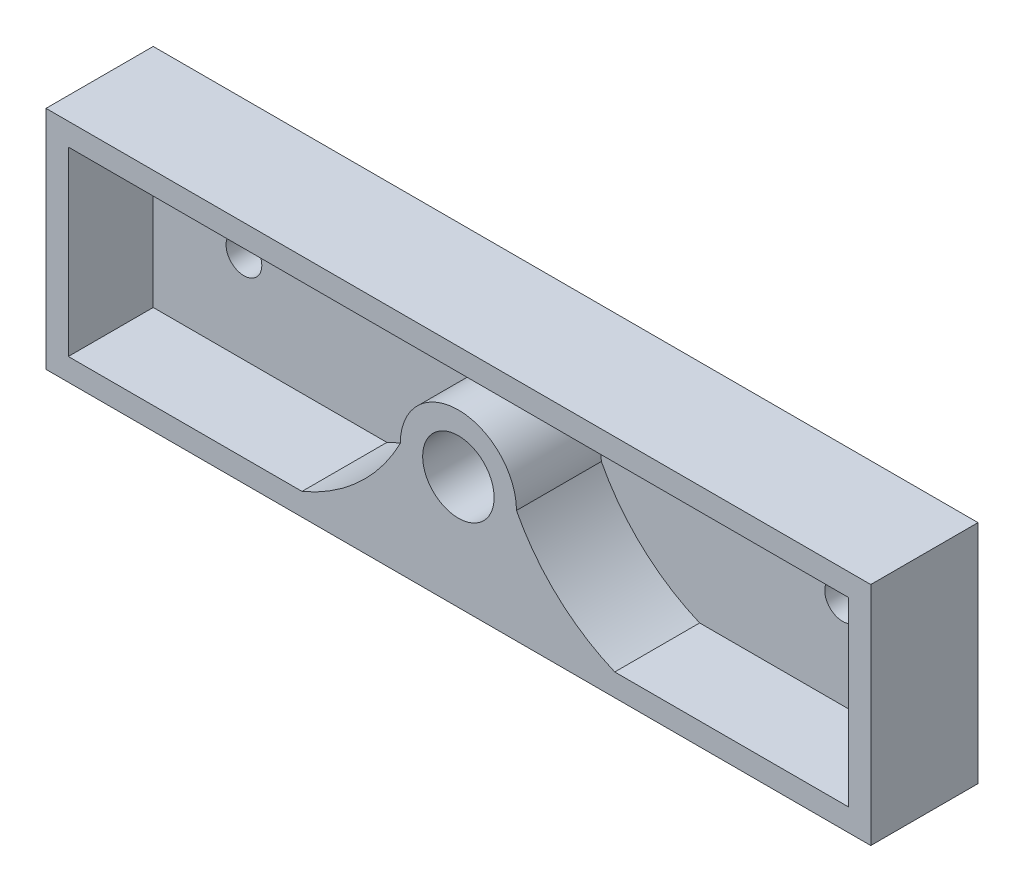
from build123d import *

# Parameters (mm, degrees)
CROQUIS2_W              = 92.3
CROQUIS2_H              = 25.3
SALIENTE_EXTRUIR1_DEPTH = 12
VACIADO1_T              = -2.5
CROQUIS3_R              = 4
CROQUIS3_R_2            = 2
CORTAR_EXTRUIR1_DEPTH   = 12
SALIENTE_EXTRUIR2_START = 9.5
CROQUIS5_R              = 4
SALIENTE_EXTRUIR2_DEPTH = 9.5


with BuildPart() as part:
    # Croquis2 → Saliente-Extruir1 (new body)
    with BuildSketch(Plane.XY):
        with Locations((46.15, 12.65)):
            Rectangle(CROQUIS2_W, CROQUIS2_H)
    extrude(amount=SALIENTE_EXTRUIR1_DEPTH)

    # Vaciado1
    vaciado1_openings = [part.faces().sort_by_distance(p)[0] for p in [
        (46.15, 12.65, 12),
    ]]
    offset(amount=VACIADO1_T, openings=vaciado1_openings, kind=Kind.INTERSECTION)

    # Croquis3 → Cortar-Extruir1 (cut)
    with BuildSketch(Plane.XY.offset(2.5)):
        with Locations((46.15, 12.65)):
            Circle(CROQUIS3_R)
        with Locations((12.65, 12.65)):
            Circle(CROQUIS3_R_2)
        with Locations((79.65, 12.65)):
            Circle(CROQUIS3_R_2)
    extrude(amount=-CORTAR_EXTRUIR1_DEPTH, mode=Mode.SUBTRACT)

    # Croquis5 → Saliente-Extruir2 (add)
    with BuildSketch(Plane.XY.offset(2.5).offset(SALIENTE_EXTRUIR2_START)):
        with BuildLine():
            Line((28.65, 2.5), (63.65, 2.5))
            ThreePointArc((63.65, 2.5), (57.258552241, 6.60889898), (52.65, 12.65))
            ThreePointArc((52.65, 12.65), (46.15, 19.15), (39.65, 12.65))
            ThreePointArc((39.65, 12.65), (35.041447759, 6.60889898), (28.65, 2.5))
        make_face()
        with Locations(Location((46.15, 12.65, 0), (0, 0, 180))):
            Circle(CROQUIS5_R, mode=Mode.SUBTRACT)
    extrude(amount=-SALIENTE_EXTRUIR2_DEPTH)


solid = part.part
